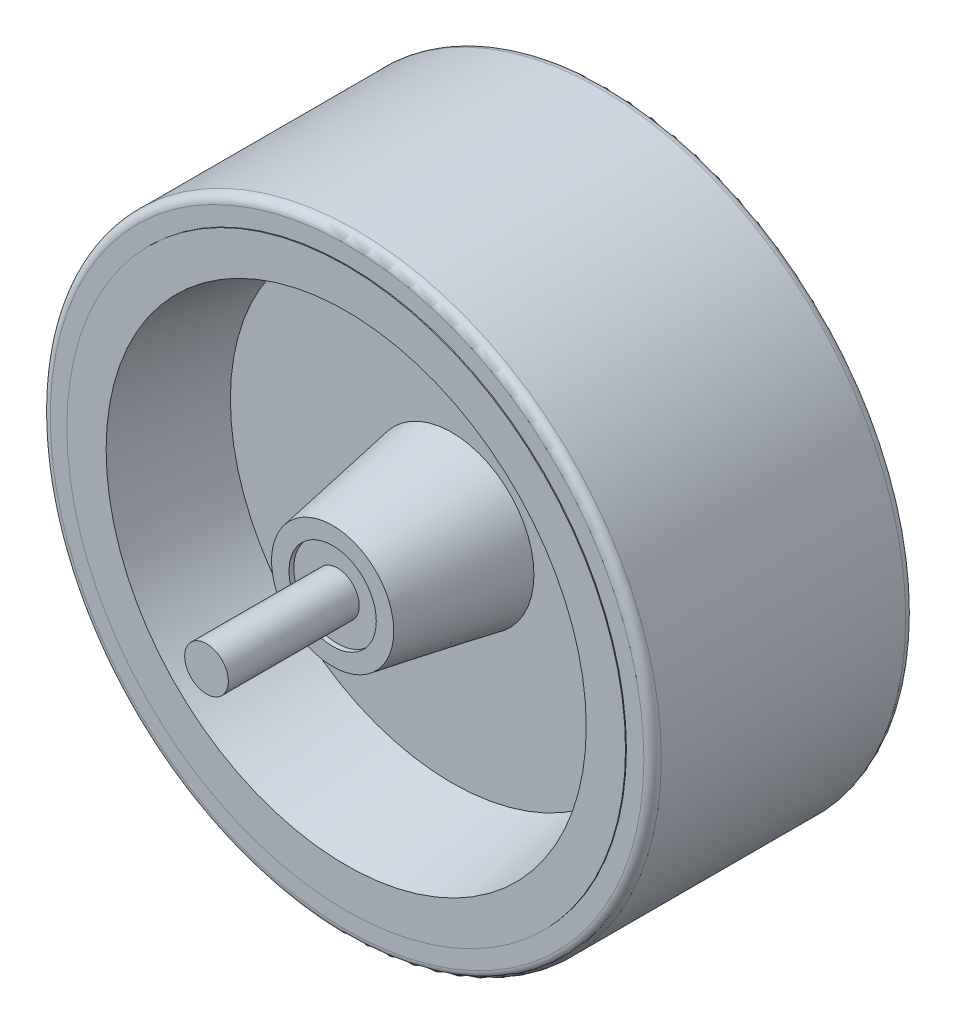
from build123d import *

# Parameters (mm, degrees)
SKETCH1_R           = 88.9
SKETCH1_R_2         = 78.74
BOSS_EXTRUDE1_DEPTH = 38.1
FILLET1_R           = 2.54
SKETCH8_R           = 6.35
BOSS_EXTRUDE2_DEPTH = 38.1
SKETCH11_R          = 6.35
BOSS_EXTRUDE3_DEPTH = 38.1


with BuildPart() as part:
    # Sketch1 → Boss-Extrude1 (new, symmetric)
    with BuildSketch(Plane.XY):
        with Locations(Location((0, 0, 0), (0, 0, 180))):
            Circle(SKETCH1_R)
        with Locations(Location((0, 0, 0), (0, 0, 180))):
            Circle(SKETCH1_R_2, mode=Mode.SUBTRACT)
    extrude(amount=BOSS_EXTRUDE1_DEPTH, both=True)

    # Fillet1
    fillet1_edges = [part.edges().sort_by_distance(p)[0] for p in [
        (88.9, 0, -38.1),
        (88.9, 0, 38.1),
    ]]
    fillet(fillet1_edges, radius=FILLET1_R)


with BuildPart() as body_2:
    # Sketch3 → Revolve1 (revolve)
    with BuildSketch(Plane(origin=(0, 0, 0), x_dir=(1, 0, 0), z_dir=(0, 1, 0)), mode=Mode.PRIVATE) as revolve1_sk:
        Polygon((0, 40.894), (0, -40.894), (-12.7, -40.894), (-12.7, -42.291), (-17.78, -42.291), (-23.893432748, -7.62), (-64.430766575, -7.62), (-69.85, -38.354), (-81.28, -38.354), (-81.28, 38.354), (-69.85, 38.354), (-64.430766575, 7.62), (-23.893432748, 7.62), (-17.78, 42.291), (-12.7, 42.291), (-12.7, 40.894), align=None)
    revolve(revolve1_sk.sketch.rotate(Axis((0, 0, 0), (0, 0, -1)), 180), axis=Axis((0, 0, 0), (0, 0, -1)))

    # Sketch8 → Boss-Extrude2 (add)
    with BuildSketch(Plane.XY.offset(40.894)):
        with Locations(Location((0, 0, 0), (0, 0, 180))):
            Circle(SKETCH8_R)
    extrude(amount=BOSS_EXTRUDE2_DEPTH)

    # Sketch11 → Boss-Extrude3 (add)
    with BuildSketch(Plane(origin=(0, 0, -40.894), x_dir=(-1, 0, 0), z_dir=(0, 0, -1))):
        Circle(SKETCH11_R)
    extrude(amount=BOSS_EXTRUDE3_DEPTH)


solid = Compound([part.part, body_2.part])
